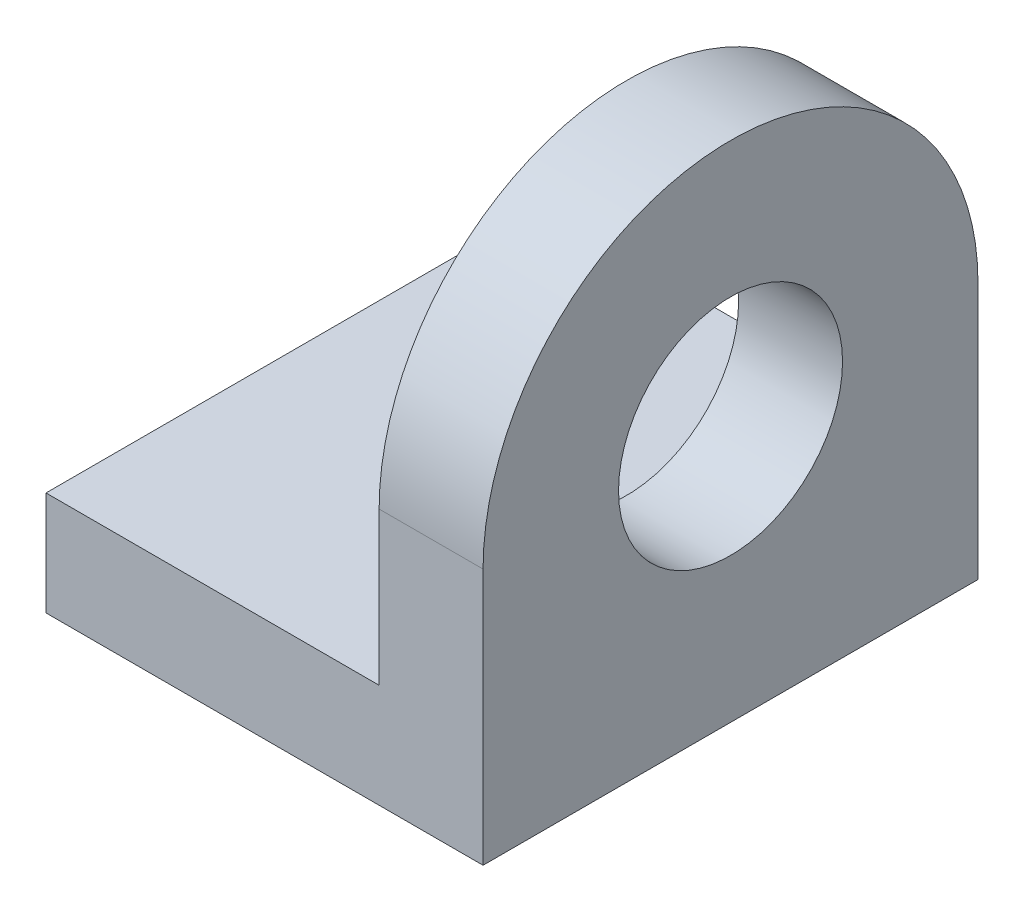
from build123d import *

# Parameters (mm, degrees)
SKETCH2_W           = 16.026033158
SKETCH2_H           = 23.810106406
BOSS_EXTRUDE1_DEPTH = 5
SKETCH3_R           = 5.388558838
BOSS_EXTRUDE2_DEPTH = 5


with BuildPart() as part:
    # Sketch2 → Boss-Extrude1 (new body)
    with BuildSketch(Plane(origin=(0, 0, 0), x_dir=(1, 0, 0), z_dir=(0, 1, 0))):
        with Locations((-8.013016579, 11.905053203)):
            Rectangle(SKETCH2_W, SKETCH2_H)
    extrude(amount=BOSS_EXTRUDE1_DEPTH)

    # Sketch3 → Boss-Extrude2 (add)
    with BuildSketch(Plane(origin=(0, 0, 0), x_dir=(0, 0, -1), z_dir=(1, 0, 0))):
        with BuildLine():
            Line((0, 0), (0, 12.341839421))
            ThreePointArc((0, 12.341839421), (11.905053203, 24.246892624), (23.810106406, 12.341839421))
            Line((23.810106406, 12.341839421), (23.810106406, 0))
            Line((23.810106406, 0), (0, 0))
        make_face()
        with Locations((11.905053203, 12.341839421)):
            Circle(SKETCH3_R, mode=Mode.SUBTRACT)
    extrude(amount=BOSS_EXTRUDE2_DEPTH)


solid = part.part
